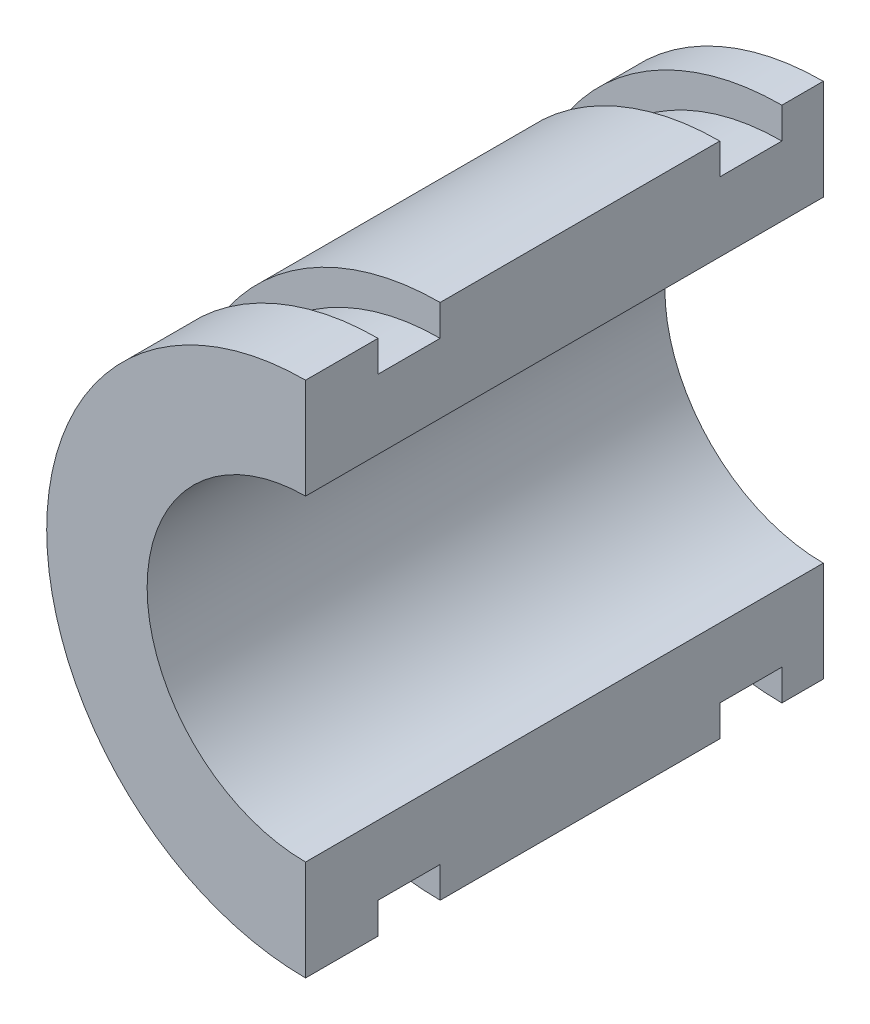
from build123d import *

# Parameters (mm, degrees)
Y_KSEKLIK_EKSTR_ZYON1_DEPTH = 25
IZIM2_W                     = 3
IZIM2_H                     = 1.5


with BuildPart() as part:
    # Çizim1 → Yükseklik-Ekstrüzyon1 (new body)
    with BuildSketch(Plane.XY):
        with BuildLine():
            Line((0, 12.5), (0, 7.65))
            ThreePointArc((0, 7.65), (-7.65, 0), (0, -7.65))
            Line((0, -7.65), (0, -12.5))
            ThreePointArc((0, -12.5), (-12.5, 0), (0, 12.5))
        make_face()
    extrude(amount=Y_KSEKLIK_EKSTR_ZYON1_DEPTH)

    # Çizim2 → Kes-Döndür1 (revolve, cut)
    with BuildSketch(Plane(origin=(0, 0, 0), x_dir=(0, 0, -1), z_dir=(1, 0, 0))):
        with Locations((-20, 11.75)):
            Rectangle(IZIM2_W, IZIM2_H)
        with Locations((-3.5, 11.75)):
            Rectangle(IZIM2_W, IZIM2_H)
    revolve(axis=Axis((0, 0, 0), (0, 0, 1)), mode=Mode.SUBTRACT)


solid = part.part
